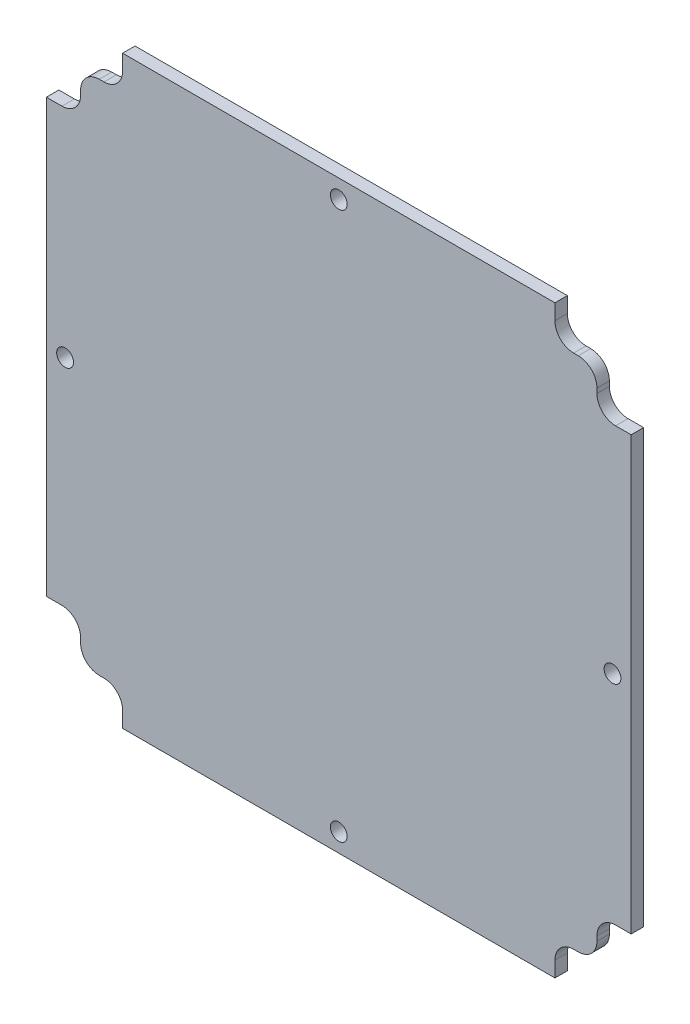
from build123d import *

# Parameters (mm, degrees)
SKETCH2_R           = 1.35
BOSS_EXTRUDE1_DEPTH = 2


with BuildPart() as part:
    # Sketch2 → Boss-Extrude1 (new body)
    with BuildSketch(Plane.XY):
        with BuildLine():
            Line((-5.815342674, -2.04814307), (-5.815342674, 0.45185693))
            ThreePointArc((-5.815342674, 0.45185693), (-4.936663017, 2.573177274), (-2.815342674, 3.45185693))
            Line((-2.815342674, 3.45185693), (-2.065342674, 3.45185693))
            ThreePointArc((-2.065342674, 3.45185693), (0.05597767, 4.330536587), (0.934657326, 6.45185693))
            Line((0.934657326, 6.45185693), (0.934657326, 7.20185693))
            ThreePointArc((0.934657326, 7.20185693), (1.813336983, 9.323177274), (3.934657326, 10.20185693))
            Line((3.934657326, 10.20185693), (6.434657326, 10.20185693))
            Line((6.434657326, 10.20185693), (6.43465612, 79.70185693))
            Line((6.43465612, 79.70185693), (3.93465612, 79.70185693))
            ThreePointArc((3.93465612, 79.70185693), (1.813335776, 80.580536587), (0.93465612, 82.70185693))
            Line((0.93465612, 82.70185693), (0.93465612, 83.45185693))
            ThreePointArc((0.93465612, 83.45185693), (0.055976464, 85.573177274), (-2.06534388, 86.45185693))
            Line((-2.06534388, 86.45185693), (-2.81534388, 86.45185693))
            ThreePointArc((-2.81534388, 86.45185693), (-4.936664224, 87.330536587), (-5.81534388, 89.45185693))
            Line((-5.81534388, 89.45185693), (-5.81534388, 91.95185693))
            Line((-5.81534388, 91.95185693), (-75.31534388, 91.95185693))
            Line((-75.31534388, 91.95185693), (-75.31534388, 89.45185693))
            ThreePointArc((-75.31534388, 89.45185693), (-76.194023536, 87.330536587), (-78.31534388, 86.45185693))
            Line((-78.31534388, 86.45185693), (-79.06534388, 86.45185693))
            ThreePointArc((-79.06534388, 86.45185693), (-81.186664224, 85.573177274), (-82.06534388, 83.45185693))
            Line((-82.06534388, 83.45185693), (-82.06534388, 82.70185693))
            ThreePointArc((-82.06534388, 82.70185693), (-82.944023536, 80.580536587), (-85.06534388, 79.70185693))
            Line((-85.06534388, 79.70185693), (-87.56534388, 79.70185693))
            Line((-87.56534388, 79.70185693), (-87.565342674, 10.20185693))
            Line((-87.565342674, 10.20185693), (-85.065342674, 10.20185693))
            ThreePointArc((-85.065342674, 10.20185693), (-82.94402233, 9.323177274), (-82.065342674, 7.20185693))
            Line((-82.065342674, 7.20185693), (-82.065342674, 6.45185693))
            ThreePointArc((-82.065342674, 6.45185693), (-81.186663017, 4.330536587), (-79.065342674, 3.45185693))
            Line((-79.065342674, 3.45185693), (-78.315342674, 3.45185693))
            ThreePointArc((-78.315342674, 3.45185693), (-76.19402233, 2.573177274), (-75.315342674, 0.45185693))
            Line((-75.315342674, 0.45185693), (-75.315342674, -2.04814307))
            Line((-75.315342674, -2.04814307), (-5.815342674, -2.04814307))
        make_face()
        with Locations((-40.56534404, 88.95185693)):
            Circle(SKETCH2_R, mode=Mode.SUBTRACT)
        with Locations((-84.565343277, 44.95185693)):
            Circle(SKETCH2_R, mode=Mode.SUBTRACT)
        with Locations((3.434656723, 44.95185693)):
            Circle(SKETCH2_R, mode=Mode.SUBTRACT)
        with Locations((-40.565342513, 0.95185693)):
            Circle(SKETCH2_R, mode=Mode.SUBTRACT)
    extrude(amount=BOSS_EXTRUDE1_DEPTH)


solid = part.part
